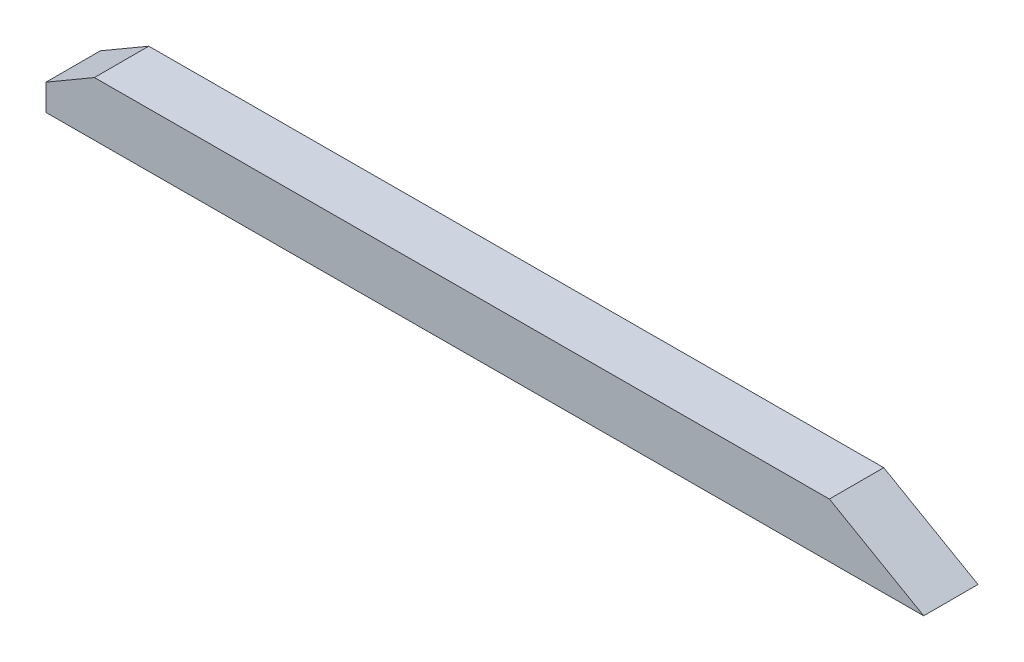
from build123d import *

# Parameters (mm, degrees)
BOSS_EXTRUDE1_DEPTH = 20


with BuildPart() as part:
    # Sketch1 → Boss-Extrude1 (new body)
    with BuildSketch(Plane.XY):
        Polygon((-345.281644436, 30.697109203), (-74.661644436, 31.605285462), (-39.953744253, 11.721649416), (-363.113744253, 10.637153667), (-363.113744253, 20.307153667), align=None)
    extrude(amount=BOSS_EXTRUDE1_DEPTH)


solid = part.part
